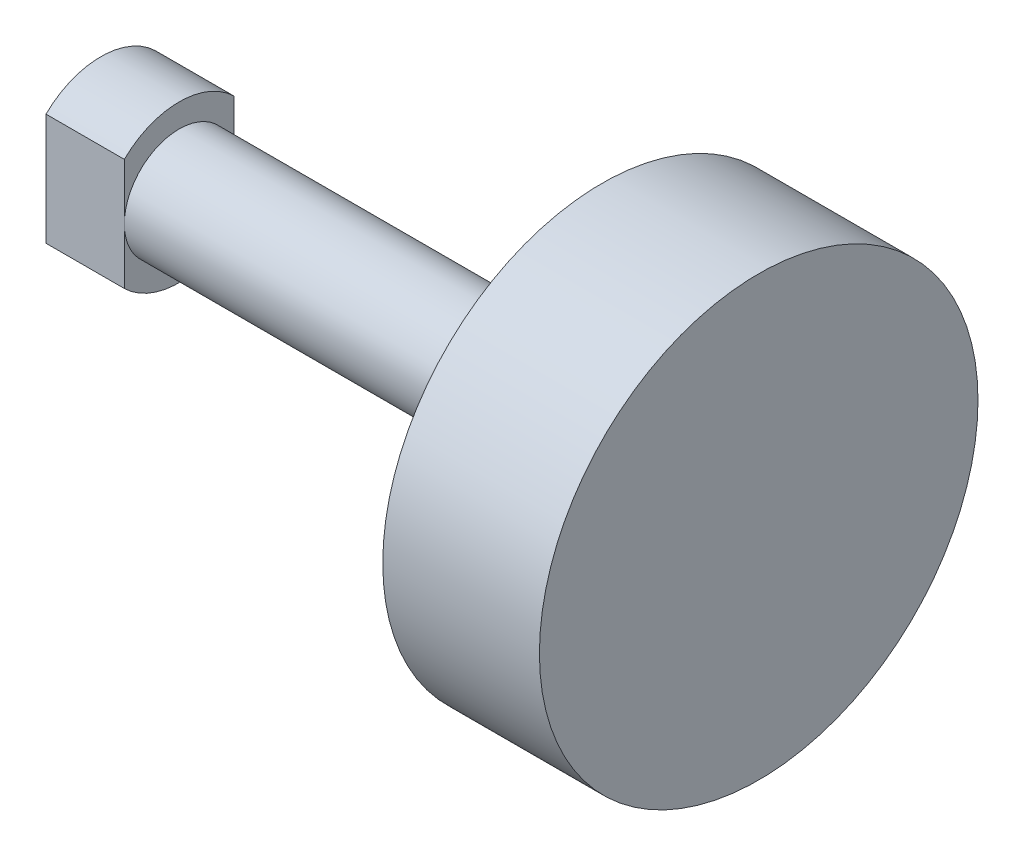
from build123d import *

# Parameters (mm, degrees)
SKETCH_7_W          = 14.843895196
SKETCH_7_H          = 27.429724107
CUT_EXTRUDE_1_DEPTH = 38.629775444
SKETCH_8_W          = 13.403160643
SKETCH_8_H          = 27.85274745
CUT_EXTRUDE_2_DEPTH = 38.629775444


with BuildPart() as part:
    # 草图1 → 旋转1 (revolve)
    with BuildSketch(Plane.XY, mode=Mode.PRIVATE) as revolve_1_sk:
        Polygon((-19.826126691, 0), (22.173873309, 0), (22.173873309, 14), (12.173873309, 14), (12.173873309, 12), (20.173873309, 12), (20.173873309, 3.5), (-14.826126691, 3.5), (-14.826126691, 5), (-19.826126691, 5), align=None)
    revolve(revolve_1_sk.sketch.rotate(Axis((-40.913023243, 0, 0), (1, 0, 0)), 90), axis=Axis((-40.913023243, 0, 0), (1, 0, 0)))

    # 草图7 → 切除-拉伸1 (cut, through all)
    with BuildSketch(Plane.ZY.offset(-12.173873309)):
        with Locations((10.921947598, -0.981485251)):
            Rectangle(SKETCH_7_W, SKETCH_7_H)
    extrude(amount=CUT_EXTRUDE_1_DEPTH, mode=Mode.SUBTRACT)

    # 草图8 → 切除-拉伸2 (cut, through all)
    with BuildSketch(Plane.ZY.offset(-12.173873309)):
        with Locations((-10.201580321, -0.432516877)):
            Rectangle(SKETCH_8_W, SKETCH_8_H)
    extrude(amount=CUT_EXTRUDE_2_DEPTH, mode=Mode.SUBTRACT)


solid = part.part
